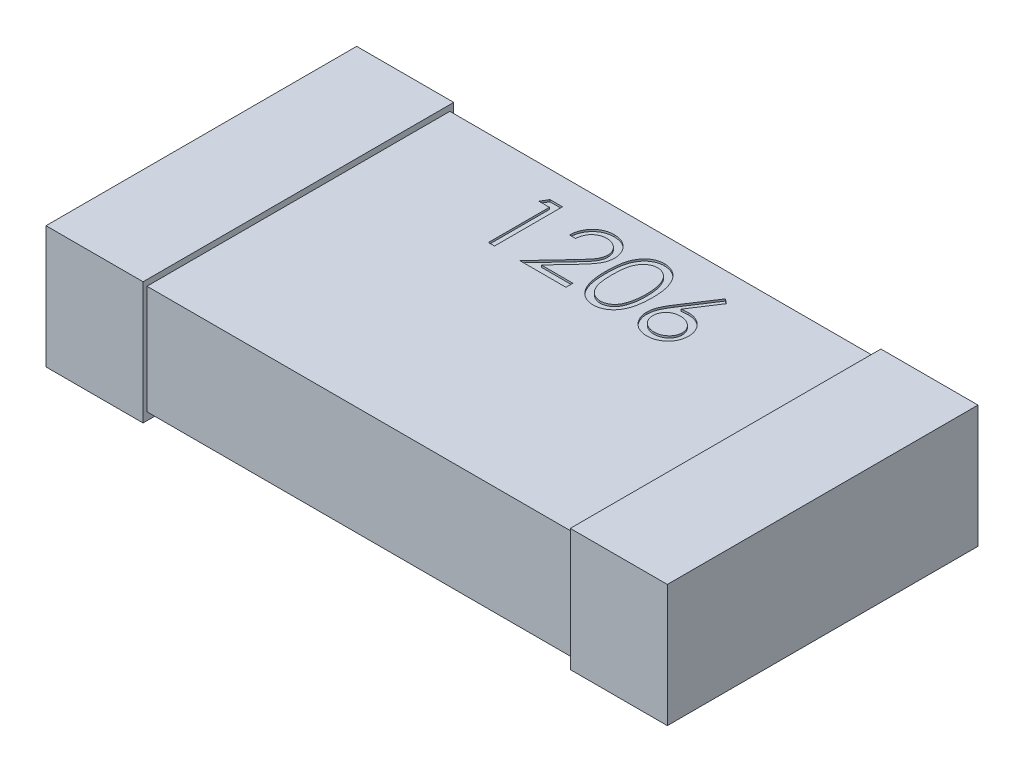
from build123d import *

# Parameters (mm, degrees)
SKETCH1_W             = 0.5
SKETCH1_H             = 1.6
BOSS_EXTRUDE1_DEPTH   = 0.63
BOSS_EXTRUDE1_2_DEPTH = 0.63
BOSS_EXTRUDE3_REACH   = 5.201
SKETCH2_W             = 1.56
SKETCH2_H             = 0.56
CUT_EXTRUDE1_DEPTH    = 0.01


with BuildPart() as part:
    # Sketch1 → Boss-Extrude1 (new body)
    with BuildSketch(Plane(origin=(0, 0, 0), x_dir=(1, 0, 0), z_dir=(0, 1, 0))):
        with Locations((0.25, 0.8)):
            Rectangle(SKETCH1_W, SKETCH1_H)
    extrude(amount=BOSS_EXTRUDE1_DEPTH)


with BuildPart() as body_2:
    # Sketch1 → Boss-Extrude1 2 (new body)
    with BuildSketch(Plane(origin=(0, 0, 0), x_dir=(1, 0, 0), z_dir=(0, 1, 0))):
        with Locations((2.95, 0.8)):
            Rectangle(SKETCH1_W, SKETCH1_H)
    extrude(amount=BOSS_EXTRUDE1_2_DEPTH)

    # Sketch2 → Boss-Extrude3 (add, up to next)
    with BuildSketch(Plane(origin=(0.5, 0, 0), x_dir=(0, 0, -1), z_dir=(1, 0, 0)), mode=Mode.PRIVATE) as boss_extrude3_sk1:
        with Locations((0.8, 0.32)):
            Rectangle(SKETCH2_W, SKETCH2_H)
    boss_extrude3_tool1 = extrude(boss_extrude3_sk1.sketch, amount=BOSS_EXTRUDE3_REACH, mode=Mode.PRIVATE) - body_2.part

    add(part.part)  # Boss-Extrude3 merges part
    add(boss_extrude3_tool1.solids().sort_by_distance((0.5, 0.32, -0.8))[0])

    # Sketch6 → Cut-Extrude1 (cut)
    # profile 1 of 4: a face of its own
    with BuildSketch(Plane(origin=(0, 0.6, 0), x_dir=(1, 0, 0), z_dir=(0, 1, 0))):
        Polygon((1.150902664, 1.444330642), (1.215616206, 1.444330642), (1.215616206, 1.094330642), (1.184205949, 1.094330642), (1.184205949, 1.408433206), (1.130359796, 1.408433206), align=None)
    # profile 2 of 4: a face of its own
    with BuildSketch(Plane(origin=(0, 0.6, 0), x_dir=(1, 0, 0), z_dir=(0, 1, 0))):
        with BuildLine():
            Line((1.390616206, 1.336638334), (1.359205949, 1.336638334))
            add(Edge.make_bspline(
                [(1.359205949, 1.336638334), (1.359410665, 1.340805423), (1.35981272, 1.348989474), (1.361695549, 1.360921865), (1.364389637, 1.372327345), (1.368198782, 1.383114336), (1.37292941, 1.393378217), (1.378602413, 1.403078219), (1.385321798, 1.412177338), (1.392942471, 1.420591222), (1.401219335, 1.428309979), (1.410149929, 1.434975503), (1.419534432, 1.44060727), (1.429344372, 1.445315395), (1.439690428, 1.448849379), (1.450478714, 1.451471543), (1.461756627, 1.453049178), (1.46944063, 1.453218756), (1.473348578, 1.453305001)],
                knots=[0, 0, 0, 0, 1.10065271, 2.161652631, 3.183658789, 4.190468796, 5.17591951, 6.163126047, 7.15150782, 8.156236427, 9.156009102, 10.134482811, 11.092018607, 12.041330605, 13.001268258, 13.972401359, 14.968799086, 16, 16, 16, 16], degree=3))
            add(Edge.make_bspline(
                [(1.473348578, 1.453305001), (1.477186385, 1.453215155), (1.48472754, 1.453038612), (1.495733741, 1.451522509), (1.50621147, 1.44914795), (1.516140247, 1.445816408), (1.525440854, 1.441337965), (1.534183158, 1.435958211), (1.542471239, 1.429736228), (1.549931917, 1.422410847), (1.556782725, 1.414590609), (1.562692951, 1.406241818), (1.567754267, 1.39761889), (1.571973035, 1.388656069), (1.575078649, 1.379268967), (1.57743647, 1.369594246), (1.578769211, 1.359531765), (1.578973754, 1.35272111), (1.579077744, 1.349258527)],
                knots=[0, 0, 0, 0, 1.111607364, 2.184268762, 3.212621178, 4.221274766, 5.211760367, 6.196651075, 7.1921475, 8.207485113, 9.220403448, 10.201281604, 11.166441695, 12.114753415, 13.065576456, 14.026450734, 14.996634279, 16, 16, 16, 16], degree=3))
            add(Edge.make_bspline(
                [(1.579077744, 1.349258527), (1.578908418, 1.344383743), (1.578572737, 1.334719722), (1.575701299, 1.320518235), (1.571216648, 1.306758894), (1.565816912, 1.295685163), (1.560369668, 1.286761814), (1.555460917, 1.279414943), (1.549714436, 1.271504397), (1.543046586, 1.263056663), (1.535595299, 1.254005572), (1.527293083, 1.244356593), (1.518080735, 1.234209416), (1.511614885, 1.227278856), (1.508264443, 1.223687613)],
                knots=[0, 0, 0, 0, 1.184426356, 2.348067706, 3.509069118, 4.696110526, 5.333549288, 6.050745305, 6.844228056, 7.710549037, 8.667450064, 9.695053472, 10.805634456, 12, 12, 12, 12], degree=3))
            Line((1.508264443, 1.223687613), (1.420694331, 1.130228078))
            Line((1.420694331, 1.130228078), (1.583564924, 1.130228078))
            Line((1.583564924, 1.130228078), (1.583564924, 1.094330642))
            Line((1.583564924, 1.094330642), (1.345744411, 1.094330642))
            Line((1.345744411, 1.094330642), (1.48148159, 1.239182405))
            add(Edge.make_bspline(
                [(1.48148159, 1.239182405), (1.484786379, 1.242632235), (1.491134202, 1.249258654), (1.50011246, 1.25893295), (1.508176358, 1.267907904), (1.515378098, 1.276166559), (1.521561448, 1.283829716), (1.527048671, 1.290649186), (1.53144523, 1.296924631), (1.53621677, 1.304198693), (1.540838168, 1.313079924), (1.544809404, 1.323933293), (1.547230889, 1.335106018), (1.547521372, 1.342656222), (1.547667488, 1.346454039)],
                knots=[0, 0, 0, 0, 1.329631726, 2.553950428, 3.673215718, 4.687767853, 5.603093632, 6.413772471, 7.123043292, 7.734684054, 8.834405432, 9.900288307, 10.943827018, 12, 12, 12, 12], degree=3))
            add(Edge.make_bspline(
                [(1.547667488, 1.346454039), (1.547603914, 1.348842179), (1.547478621, 1.353548744), (1.546372851, 1.36044932), (1.544701801, 1.367105802), (1.542307275, 1.373538663), (1.539146601, 1.379683229), (1.535299263, 1.385546977), (1.530860257, 1.391215873), (1.52572513, 1.396531203), (1.520083978, 1.401399324), (1.514124553, 1.405711732), (1.507819542, 1.409315643), (1.50119553, 1.412269993), (1.494270983, 1.414587531), (1.487032509, 1.416193389), (1.479500107, 1.417201637), (1.474356757, 1.417338055), (1.471735998, 1.417407565)],
                knots=[0, 0, 0, 0, 0.991446411, 1.95395049, 2.89581595, 3.838931463, 4.798493298, 5.75982156, 6.748411868, 7.785213223, 8.824556874, 9.840280684, 10.836137867, 11.835679398, 12.848801643, 13.863922112, 14.911575587, 16, 16, 16, 16], degree=3))
            add(Edge.make_bspline(
                [(1.471735998, 1.417407565), (1.468998914, 1.417336062), (1.463623735, 1.417195641), (1.455731831, 1.416213375), (1.448203254, 1.414518791), (1.441019063, 1.412201123), (1.434167105, 1.409255269), (1.4276807, 1.405586094), (1.421574411, 1.401207745), (1.415836759, 1.396243689), (1.410550361, 1.390716929), (1.405905674, 1.384555933), (1.401847272, 1.377873191), (1.398306349, 1.370686736), (1.39543078, 1.362931358), (1.393233465, 1.354634588), (1.39149478, 1.345832449), (1.390913928, 1.339753941), (1.390616206, 1.336638334)],
                knots=[0, 0, 0, 0, 1.031018746, 2.02475058, 2.990194455, 3.934040569, 4.864654155, 5.795059489, 6.735614925, 7.690564532, 8.649604399, 9.611025574, 10.590972636, 11.591080095, 12.624614302, 13.701020113, 14.821632451, 16, 16, 16, 16], degree=3))
        make_face()
    # profile 3 of 4: a face of its own
    with BuildSketch(Plane(origin=(0, 0.6, 0), x_dir=(1, 0, 0), z_dir=(0, 1, 0))):
        with BuildLine():
            add(Edge.make_bspline(
                [(1.61497518, 1.269190418), (1.615007982, 1.274800156), (1.6150717, 1.285697155), (1.615780542, 1.301575619), (1.616958076, 1.316471648), (1.618571814, 1.330385954), (1.620535612, 1.343322131), (1.62315716, 1.355245607), (1.626138441, 1.366211567), (1.629593685, 1.376255772), (1.633492464, 1.385513542), (1.63773589, 1.394156063), (1.64249237, 1.402170256), (1.647490061, 1.409684035), (1.652931268, 1.416574404), (1.658661147, 1.422938671), (1.664903335, 1.428629746), (1.671445636, 1.433814376), (1.678347282, 1.438359323), (1.685411549, 1.442362597), (1.692687059, 1.445782584), (1.700193677, 1.448471627), (1.707863933, 1.450692712), (1.71572464, 1.452211607), (1.723788776, 1.453167298), (1.72923192, 1.453258664), (1.731992408, 1.453305001)],
                knots=[0, 0, 0, 0, 1.646270934, 3.197905019, 4.663502075, 6.030701355, 7.308322542, 8.50163776, 9.611534131, 10.641858119, 11.616356847, 12.558055219, 13.465016945, 14.349605745, 15.204443733, 16.039544428, 16.859896111, 17.680448484, 18.487036065, 19.28249412, 20.06191084, 20.843045899, 21.620316918, 22.403196591, 23.190181807, 24, 24, 24, 24], degree=3))
            add(Edge.make_bspline(
                [(1.731992408, 1.453305001), (1.734775956, 1.453256219), (1.740311557, 1.453159208), (1.748495594, 1.452226814), (1.756490562, 1.450679702), (1.764262376, 1.448487604), (1.771874875, 1.445768037), (1.779268516, 1.442359325), (1.786489224, 1.438391438), (1.793422252, 1.43372905), (1.800143714, 1.428530823), (1.80648851, 1.422654556), (1.812457219, 1.416159584), (1.818124749, 1.409115398), (1.823330309, 1.401386889), (1.828287652, 1.393108478), (1.832724856, 1.384135392), (1.836998323, 1.374617345), (1.840687022, 1.364290979), (1.844013647, 1.353214503), (1.846701543, 1.341257084), (1.848940471, 1.32848146), (1.85067496, 1.314840711), (1.851938225, 1.30036408), (1.852605533, 1.285042041), (1.852731203, 1.274566256), (1.852795693, 1.269190418)],
                knots=[0, 0, 0, 0, 0.810914788, 1.612654377, 2.396697861, 3.181598691, 3.963628158, 4.749916497, 5.551656086, 6.361998678, 7.18212741, 8.025565596, 8.878627764, 9.750805457, 10.657531673, 11.591944965, 12.560506719, 13.57287815, 14.630710178, 15.753379473, 16.941251878, 18.199788006, 19.531962791, 20.947069417, 22.433333509, 24, 24, 24, 24], degree=3))
            add(Edge.make_bspline(
                [(1.852795693, 1.269190418), (1.852730535, 1.263838027), (1.852603576, 1.253409112), (1.851945705, 1.238156014), (1.850649842, 1.22375621), (1.849028843, 1.210175164), (1.846783747, 1.197469402), (1.84402323, 1.185594957), (1.840958198, 1.17450055), (1.837174719, 1.164277068), (1.833033648, 1.154781896), (1.828528128, 1.145915181), (1.823701146, 1.137598552), (1.818442271, 1.129898577), (1.81283693, 1.122760712), (1.806765151, 1.116310949), (1.800398092, 1.110393882), (1.793656851, 1.105128719), (1.786615696, 1.100520239), (1.779419788, 1.096398854), (1.77194145, 1.093075584), (1.764350154, 1.09022208), (1.756537318, 1.088042035), (1.748512679, 1.08653465), (1.740317055, 1.085477465), (1.734776899, 1.085396817), (1.731992408, 1.085356283)],
                knots=[0, 0, 0, 0, 1.561518951, 3.042555995, 4.452378317, 5.7783523, 7.031515105, 8.214008947, 9.334062868, 10.386615937, 11.391082383, 12.354592575, 13.286541444, 14.194233754, 15.072674879, 15.931287219, 16.775624067, 17.606195743, 18.42308326, 19.229000347, 20.022332153, 20.807536673, 21.593273796, 22.3848459, 23.188221202, 24, 24, 24, 24], degree=3))
            add(Edge.make_bspline(
                [(1.731992408, 1.085356283), (1.729231996, 1.085402919), (1.723789004, 1.085494875), (1.715723761, 1.086446248), (1.707895517, 1.087975798), (1.700265642, 1.090117459), (1.69279499, 1.092738942), (1.685585361, 1.096154311), (1.678556593, 1.100087717), (1.671727437, 1.10456726), (1.665226221, 1.109699428), (1.659016361, 1.115375857), (1.653253859, 1.121738198), (1.647890449, 1.12868599), (1.642793041, 1.136155314), (1.638104103, 1.144248152), (1.633767018, 1.152932413), (1.629802669, 1.162264204), (1.626287802, 1.172379697), (1.623183032, 1.183394615), (1.620731616, 1.195406178), (1.61863332, 1.208317915), (1.616940882, 1.222185308), (1.615785449, 1.237015886), (1.615071318, 1.252800407), (1.615007811, 1.263627384), (1.61497518, 1.269190418)],
                knots=[0, 0, 0, 0, 0.810891512, 1.598919785, 2.382837074, 3.152667961, 3.926044502, 4.706494248, 5.493654104, 6.291793342, 7.103789334, 7.925228297, 8.761435821, 9.622817696, 10.50288917, 11.416980706, 12.369136599, 13.353924996, 14.394355917, 15.514179734, 16.714354668, 17.994756427, 19.357759367, 20.818452758, 22.365282078, 24, 24, 24, 24], degree=3))
        make_face()
        with BuildLine():
            add(Edge.make_bspline(
                [(1.646385437, 1.269330642), (1.646397381, 1.264655772), (1.646420564, 1.255582768), (1.647026184, 1.242398441), (1.647851207, 1.230101409), (1.648915337, 1.218676055), (1.650495632, 1.208161054), (1.65226631, 1.198484085), (1.654421119, 1.189696362), (1.656970621, 1.181737581), (1.659874531, 1.174472674), (1.663045117, 1.167712552), (1.666451189, 1.161377359), (1.670263104, 1.155523998), (1.674414611, 1.150133381), (1.678811937, 1.145110098), (1.683619195, 1.1406304), (1.690269569, 1.135257715), (1.699049217, 1.129705801), (1.710111262, 1.124871192), (1.721478107, 1.121832947), (1.729193232, 1.121446571), (1.73304409, 1.121253719)],
                knots=[0, 0, 0, 0, 1.459021318, 2.831673884, 4.118529203, 5.306027144, 6.411944654, 7.436330062, 8.375795394, 9.233974572, 10.042671642, 10.816086306, 11.563610507, 12.285937304, 12.993564865, 13.685989202, 14.367179055, 15.041617293, 16.353048772, 17.594441528, 18.799311195, 20, 20, 20, 20], degree=3))
            add(Edge.make_bspline(
                [(1.73304409, 1.121253719), (1.736919858, 1.121413497), (1.74466339, 1.121732723), (1.755976769, 1.124812597), (1.766959796, 1.129459551), (1.775566991, 1.134954301), (1.782115245, 1.140187134), (1.786806944, 1.144648599), (1.791113149, 1.149644186), (1.795197356, 1.155034116), (1.798943264, 1.160921364), (1.802349578, 1.167277622), (1.805457912, 1.174120539), (1.807228817, 1.178897513), (1.808134235, 1.181339857)],
                knots=[0, 0, 0, 0, 1.353760809, 2.704726607, 4.075137775, 5.516104923, 6.260822281, 7.007110065, 7.778089737, 8.566572457, 9.372053459, 10.217411131, 11.088608312, 12, 12, 12, 12], degree=3))
            add(Edge.make_bspline(
                [(1.808134235, 1.181339857), (1.809189411, 1.184462831), (1.811331873, 1.190803807), (1.81409305, 1.200640172), (1.81626759, 1.210960449), (1.818223927, 1.22170296), (1.819559232, 1.23294693), (1.820634014, 1.244657569), (1.821267082, 1.256843705), (1.821345558, 1.265123204), (1.821385437, 1.269330642)],
                knots=[0, 0, 0, 0, 0.884706709, 1.796334032, 2.740027952, 3.714592787, 4.726048262, 5.777819803, 6.87074269, 8, 8, 8, 8], degree=3))
            add(Edge.make_bspline(
                [(1.821385437, 1.269330642), (1.821330418, 1.273537399), (1.821222789, 1.281766716), (1.82081139, 1.293818534), (1.819749033, 1.30526531), (1.818569121, 1.316156357), (1.816829399, 1.326431387), (1.814953618, 1.336176418), (1.812433497, 1.34527072), (1.809741519, 1.353856679), (1.80666048, 1.361836744), (1.803268906, 1.369248123), (1.79964673, 1.376126595), (1.795712506, 1.382453289), (1.791512938, 1.388256544), (1.786937183, 1.393420003), (1.782166746, 1.3981037), (1.775485027, 1.403449957), (1.766737598, 1.408901126), (1.755853034, 1.413917702), (1.744525969, 1.416798532), (1.736868624, 1.4172047), (1.73304409, 1.417407565)],
                knots=[0, 0, 0, 0, 1.31362396, 2.569729283, 3.763502607, 4.902122613, 5.988968491, 7.01645872, 7.998833611, 8.933434873, 9.825090667, 10.667526885, 11.477055099, 12.250526234, 12.991942729, 13.710640831, 14.402115721, 15.076753259, 16.378508321, 17.609869233, 18.806226677, 20, 20, 20, 20], degree=3))
            add(Edge.make_bspline(
                [(1.73304409, 1.417407565), (1.729173031, 1.41720442), (1.721423861, 1.416797761), (1.709979065, 1.413928436), (1.69900863, 1.408927139), (1.690284333, 1.403431902), (1.683597954, 1.398198071), (1.678889685, 1.393659425), (1.674475067, 1.3886948), (1.670408297, 1.383254608), (1.666599369, 1.377408072), (1.663101268, 1.371109195), (1.659949535, 1.364326059), (1.657041081, 1.357064415), (1.654483802, 1.349106321), (1.652374406, 1.340329421), (1.650425701, 1.330683232), (1.649046174, 1.320111281), (1.647819798, 1.308683066), (1.647031664, 1.296355334), (1.646418538, 1.283148896), (1.646396691, 1.27402898), (1.646385437, 1.269330642)],
                knots=[0, 0, 0, 0, 1.207732386, 2.417664972, 3.655092373, 4.956220595, 5.625982001, 6.301752483, 6.994047911, 7.697131622, 8.419323945, 9.170223765, 9.943494443, 10.752040957, 11.610060368, 12.549350801, 13.567764191, 14.679664412, 15.874934091, 17.154273443, 18.533957287, 20, 20, 20, 20], degree=3))
        make_face(mode=Mode.SUBTRACT)
    # profile 4 of 4: a face of its own
    with BuildSketch(Plane(origin=(0, 0.6, 0), x_dir=(1, 0, 0), z_dir=(0, 1, 0))):
        with BuildLine():
            Line((2.045744411, 1.453305001), (2.069933113, 1.4343046))
            Line((2.069933113, 1.4343046), (1.977455148, 1.292888334))
            add(Edge.make_bspline(
                [(1.977455148, 1.292888334), (1.983612176, 1.29386972), (1.995622155, 1.295784025), (2.007778744, 1.296099819), (2.013703145, 1.296253719)],
                knots=[0, 0, 0, 0, 1.025318673, 2, 2, 2, 2], degree=3))
            add(Edge.make_bspline(
                [(2.013703145, 1.296253719), (2.017260395, 1.296158108), (2.024262735, 1.2959699), (2.034543415, 1.294521515), (2.044422308, 1.292239004), (2.05385847, 1.288911778), (2.062885768, 1.284661543), (2.071556007, 1.279567656), (2.079706209, 1.273367088), (2.087441326, 1.266440592), (2.094464036, 1.258768894), (2.100681642, 1.25062876), (2.105904321, 1.242028672), (2.110141713, 1.232972985), (2.113432201, 1.223475659), (2.115830965, 1.213548845), (2.117248925, 1.203185698), (2.117441474, 1.196137881), (2.117539283, 1.192557805)],
                knots=[0, 0, 0, 0, 1.04369286, 2.054478336, 3.041073146, 4.015093852, 4.984733326, 5.965804835, 6.960378782, 7.985147595, 9.009457201, 10.008161701, 10.986880575, 11.956520048, 12.937015923, 13.931873656, 14.949455224, 16, 16, 16, 16], degree=3))
            add(Edge.make_bspline(
                [(2.117539283, 1.192557805), (2.117396972, 1.187659835), (2.117116939, 1.178021788), (2.114326559, 1.163984118), (2.109990595, 1.150610866), (2.103792842, 1.138115549), (2.096094604, 1.126515292), (2.086706844, 1.116236746), (2.075962496, 1.107069742), (2.063813816, 1.09940408), (2.050739519, 1.093143775), (2.03700432, 1.088647251), (2.022741605, 1.085878904), (2.013061144, 1.085531843), (2.008164283, 1.085356283)],
                knots=[0, 0, 0, 0, 1.031375318, 2.029502543, 3.004789286, 3.987476834, 4.960371455, 5.9300674, 6.912260825, 7.929083631, 8.949397511, 9.960523116, 10.96833055, 12, 12, 12, 12], degree=3))
            add(Edge.make_bspline(
                [(2.008164283, 1.085356283), (2.003454613, 1.085509104), (1.994125581, 1.085811814), (1.980402302, 1.088508408), (1.967216, 1.092879118), (1.954659062, 1.098900546), (1.943027, 1.106506335), (1.932620437, 1.115662562), (1.923491259, 1.126173509), (1.915893797, 1.138037544), (1.909867924, 1.150786539), (1.905348931, 1.164080255), (1.902709307, 1.177870253), (1.902340451, 1.187218367), (1.902154667, 1.191926796)],
                knots=[0, 0, 0, 0, 1.012016664, 2.004627821, 2.994792927, 3.992885782, 4.990978636, 5.973936114, 6.964471063, 7.975201453, 8.993600317, 9.990122807, 10.98767138, 12, 12, 12, 12], degree=3))
            add(Edge.make_bspline(
                [(1.902154667, 1.191926796), (1.902272812, 1.195531254), (1.90251404, 1.202890869), (1.904198379, 1.214037272), (1.906904859, 1.22544238), (1.909935884, 1.2351178), (1.913138445, 1.243043952), (1.915803699, 1.249434301), (1.919121098, 1.256010408), (1.922658436, 1.262997772), (1.926734123, 1.270216315), (1.931165688, 1.277786682), (1.936075653, 1.285588475), (1.939517669, 1.290882894), (1.941277264, 1.293589456)],
                knots=[0, 0, 0, 0, 1.173818275, 2.396712641, 3.66331629, 4.989737886, 5.693666774, 6.447286557, 7.243889047, 8.091586357, 8.998013824, 9.943181721, 10.948533338, 12, 12, 12, 12], degree=3))
            Line((1.941277264, 1.293589456), (2.045744411, 1.453305001))
        make_face()
        with BuildLine():
            add(Edge.make_bspline(
                [(2.0071126, 1.260356283), (2.004446376, 1.260278479), (1.999238465, 1.260126504), (1.991597723, 1.259243979), (1.984366398, 1.257582072), (1.977448685, 1.255465439), (1.970973914, 1.252555133), (1.96489503, 1.249019953), (1.959188525, 1.244857835), (1.95391417, 1.240127744), (1.949132204, 1.234948941), (1.945014091, 1.229401989), (1.941461851, 1.223620569), (1.938573669, 1.217556374), (1.936324661, 1.211211724), (1.934697836, 1.204615799), (1.933792461, 1.197724369), (1.933641838, 1.193051119), (1.933564924, 1.190664777)],
                knots=[0, 0, 0, 0, 1.129588631, 2.206414736, 3.251139165, 4.268635594, 5.265702196, 6.250456724, 7.242448911, 8.251968645, 9.246821453, 10.222880186, 11.173611482, 12.116736599, 13.062300278, 14.020270554, 14.989073742, 16, 16, 16, 16], degree=3))
            add(Edge.make_bspline(
                [(1.933564924, 1.190664777), (1.93362756, 1.188299779), (1.93375038, 1.18366237), (1.934865612, 1.176828452), (1.93656912, 1.170251961), (1.93910316, 1.163966801), (1.942125849, 1.157877169), (1.946116381, 1.152203641), (1.95053806, 1.146601634), (1.955823453, 1.141501486), (1.961495789, 1.136755824), (1.96755591, 1.132607799), (1.973871906, 1.129059181), (1.980529048, 1.126278072), (1.987432886, 1.123995643), (1.994640942, 1.122389495), (2.002158227, 1.121481442), (2.007250421, 1.121330623), (2.009846975, 1.121253719)],
                knots=[0, 0, 0, 0, 0.989467248, 1.94019797, 2.891935182, 3.827694429, 4.772920941, 5.730924762, 6.725747692, 7.756678648, 8.79901574, 9.819492441, 10.826891316, 11.826466727, 12.835195252, 13.867842842, 14.912794438, 16, 16, 16, 16], degree=3))
            add(Edge.make_bspline(
                [(2.009846975, 1.121253719), (2.012443525, 1.121330629), (2.01753571, 1.12148146), (2.025053056, 1.122389427), (2.032260888, 1.123995892), (2.039165539, 1.126277169), (2.045819682, 1.12906253), (2.052130154, 1.132585722), (2.058132964, 1.136781334), (2.063809024, 1.141493376), (2.069072418, 1.146630662), (2.073600145, 1.152153634), (2.077468469, 1.157923023), (2.080611887, 1.163942812), (2.083118017, 1.170255761), (2.084830163, 1.176827434), (2.085943092, 1.183662636), (2.086066229, 1.188299869), (2.086129026, 1.190664777)],
                knots=[0, 0, 0, 0, 1.087397944, 2.132534446, 3.165364764, 4.174271784, 5.174024072, 6.181601208, 7.194203697, 8.236725232, 9.267838612, 10.269026844, 11.221737037, 12.171628256, 13.107553087, 14.05945871, 15.010357665, 16, 16, 16, 16], degree=3))
            add(Edge.make_bspline(
                [(2.086129026, 1.190664777), (2.086073997, 1.193054232), (2.085965992, 1.197743955), (2.084744398, 1.204612717), (2.08305016, 1.211245237), (2.080491857, 1.217599832), (2.077168203, 1.223651425), (2.073119862, 1.229430585), (2.068436605, 1.23498162), (2.063026851, 1.240137901), (2.057137828, 1.244852608), (2.050876269, 1.249014564), (2.044325472, 1.252527062), (2.037492077, 1.255457772), (2.030297789, 1.257572719), (2.022858755, 1.259238044), (2.015079831, 1.260124245), (2.00980217, 1.260277952), (2.0071126, 1.260356283)],
                knots=[0, 0, 0, 0, 0.978206639, 1.919901502, 2.851605144, 3.780102724, 4.718870031, 5.675451981, 6.667674623, 7.690630536, 8.733308323, 9.756129687, 10.767539656, 11.776269907, 12.797430371, 13.836405707, 14.897401972, 16, 16, 16, 16], degree=3))
        make_face(mode=Mode.SUBTRACT)
    extrude(amount=-CUT_EXTRUDE1_DEPTH, mode=Mode.SUBTRACT)


solid = body_2.part
